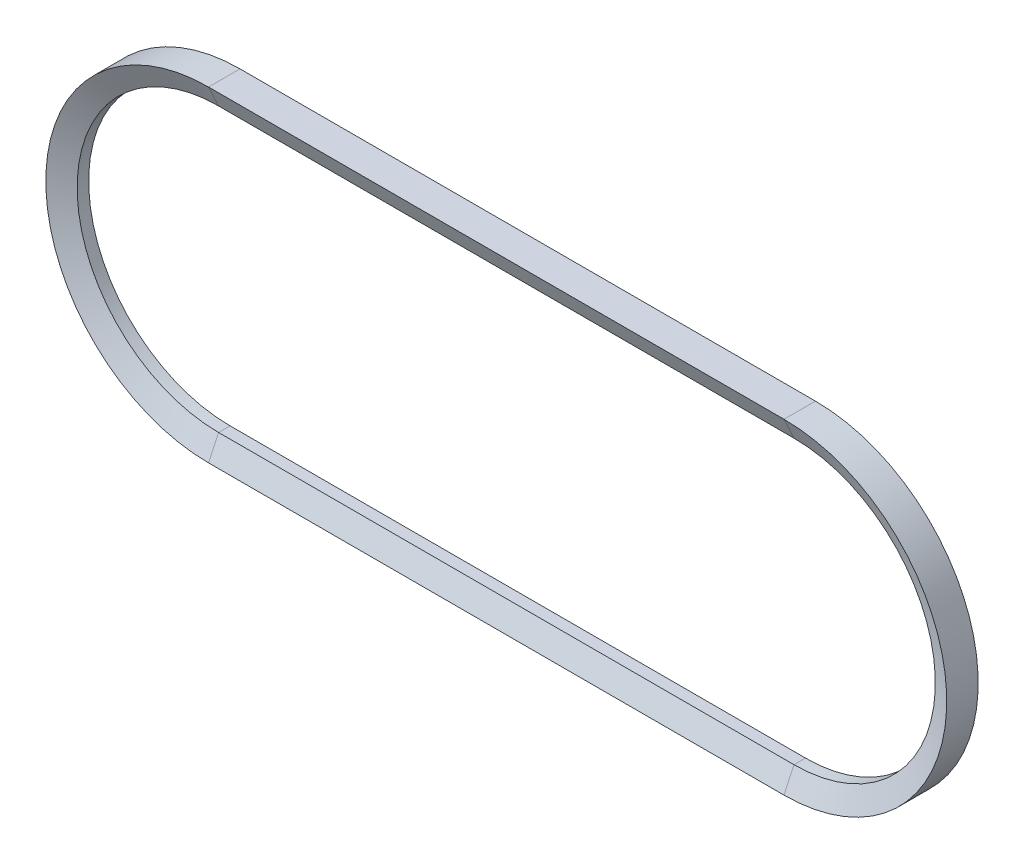
from build123d import *


with BuildPart() as part:
    # Barrer1: sweep along a path in Croquis2
    with BuildLine(Plane.XY) as barrer1_path:
        Line((0, 172), (700, 172))
        ThreePointArc((700, 172), (872, 0), (700, -172))
        Line((700, -172), (0, -172))
        ThreePointArc((0, -172), (-172, 0), (0, 172))
    # Croquis3 → Barrer1 (sweep)
    with BuildSketch(Plane(origin=(0, 0, 0), x_dir=(0, 0, -1), z_dir=(1, 0, 0))):
        Polygon((-7, 172), (7, 172), (19.123999112, 198), (-19.123999112, 198), align=None)
    sweep(path=barrer1_path.line)


solid = part.part
